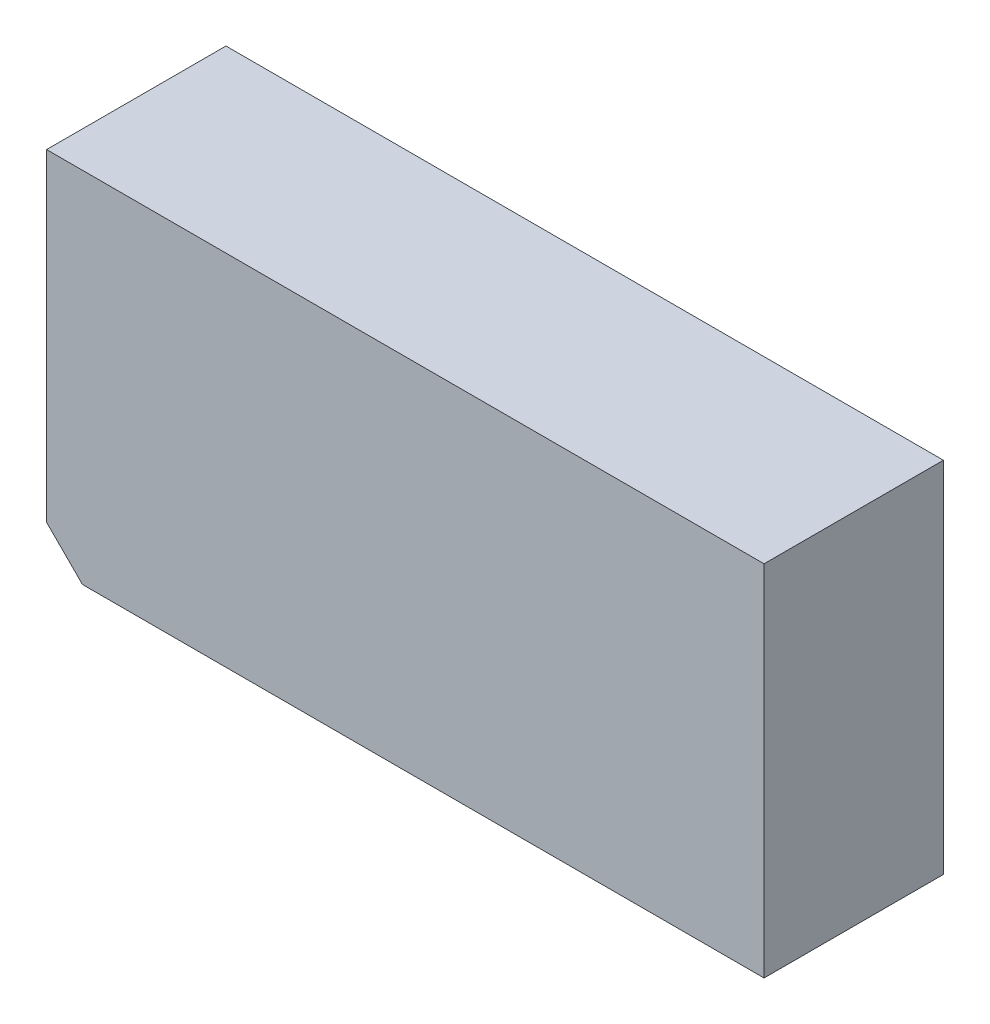
from build123d import *

# Parameters (mm, degrees)
SKETCH1_W           = 40
SKETCH1_H           = 20
BOSS_EXTRUDE1_DEPTH = 10
CHAMFER1_SIZE       = 2


with BuildPart() as part:
    # Sketch1 → Boss-Extrude1 (new body)
    with BuildSketch(Plane.XY):
        with Locations((20, 10)):
            Rectangle(SKETCH1_W, SKETCH1_H)
    extrude(amount=BOSS_EXTRUDE1_DEPTH)

    # Chamfer1
    chamfer1_edges = [part.edges().sort_by_distance(p)[0] for p in [
        (0, 0, 5),
    ]]
    chamfer(chamfer1_edges, length=CHAMFER1_SIZE)


solid = part.part
